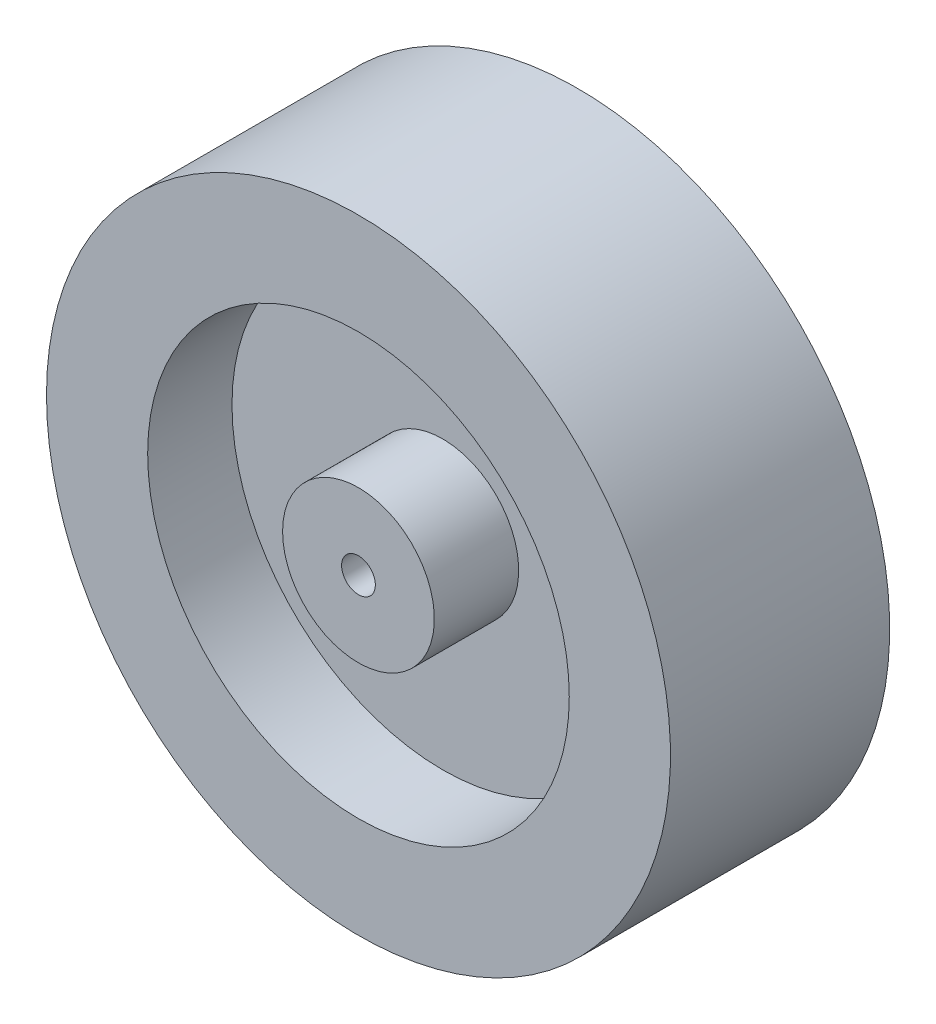
from build123d import *

# Parameters (mm, degrees)
SKETCH1_R           = 37
SKETCH1_R_2         = 2
BOSS_EXTRUDE1_DEPTH = 26
SKETCH2_R           = 25
SKETCH2_R_2         = 9
CUT_EXTRUDE1_DEPTH  = 10


with BuildPart() as part:
    # Sketch1 → Boss-Extrude1 (new body)
    with BuildSketch(Plane.XY):
        with Locations(Location((0, 0, 0), (0, 0, 180))):
            Circle(SKETCH1_R)
        with Locations(Location((0, 0, 0), (0, 0, 180))):
            Circle(SKETCH1_R_2, mode=Mode.SUBTRACT)
    extrude(amount=BOSS_EXTRUDE1_DEPTH)

    # Sketch2 → Cut-Extrude1 (cut)
    with BuildSketch(Plane(origin=(0, 0, 0), x_dir=(-1, 0, 0), z_dir=(0, 0, -1))):
        Circle(SKETCH2_R)
        Circle(SKETCH2_R_2, mode=Mode.SUBTRACT)
    cut_extrude1 = extrude(amount=-CUT_EXTRUDE1_DEPTH, mode=Mode.SUBTRACT)

    # Mirror1: Cut-Extrude1 across plane
    add(cut_extrude1.mirror(Plane(origin=(0, 0, 13), x_dir=(1, 0, 0), z_dir=(0, 0, -1))), mode=Mode.SUBTRACT)


solid = part.part
